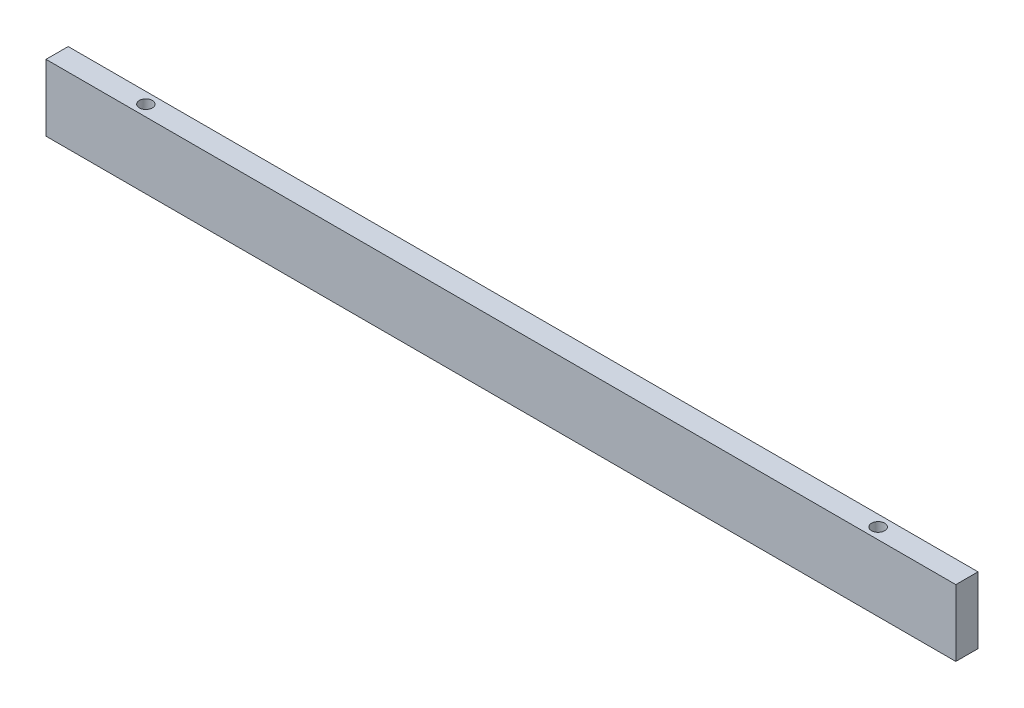
from build123d import *

# Parameters (mm, degrees)
SKETCH1_W           = 260.35
SKETCH1_H           = 19.05
BOSS_EXTRUDE1_DEPTH = 6.35
SKETCH2_R           = 1.88358262
SKETCH2_R_2         = 1.866453282
CUT_EXTRUDE1_DEPTH  = 6.35
SKETCH3_R           = 1.849990648
CUT_EXTRUDE2_DEPTH  = 6.35


with BuildPart() as part:
    # Sketch1 → Boss-Extrude1 (new body)
    with BuildSketch(Plane.XY):
        with Locations((130.175, -9.525)):
            Rectangle(SKETCH1_W, SKETCH1_H)
    extrude(amount=BOSS_EXTRUDE1_DEPTH)

    # Sketch2 → Cut-Extrude1 (cut)
    with BuildSketch(Plane(origin=(0, 0, 0), x_dir=(1, 0, 0), z_dir=(0, 1, 0))):
        with Locations(Location((234.95, -3.175, 0), (0, 0, 270))):
            Circle(SKETCH2_R)
        with Locations(Location((25.4, -3.175, 0), (0, 0, 270))):
            Circle(SKETCH2_R_2)
    extrude(amount=-CUT_EXTRUDE1_DEPTH, mode=Mode.SUBTRACT)

    # Sketch3 → Cut-Extrude2 (cut)
    with BuildSketch(Plane(origin=(0, -19.05, 0), x_dir=(-1, 0, 0), z_dir=(0, -1, 0))):
        with Locations(Location((-222.25, -3.175, 0), (0, 0, 90))):
            Circle(SKETCH3_R)
        with Locations(Location((-38.1, -3.175, 0), (0, 0, 90))):
            Circle(SKETCH3_R)
    extrude(amount=-CUT_EXTRUDE2_DEPTH, mode=Mode.SUBTRACT)


solid = part.part
